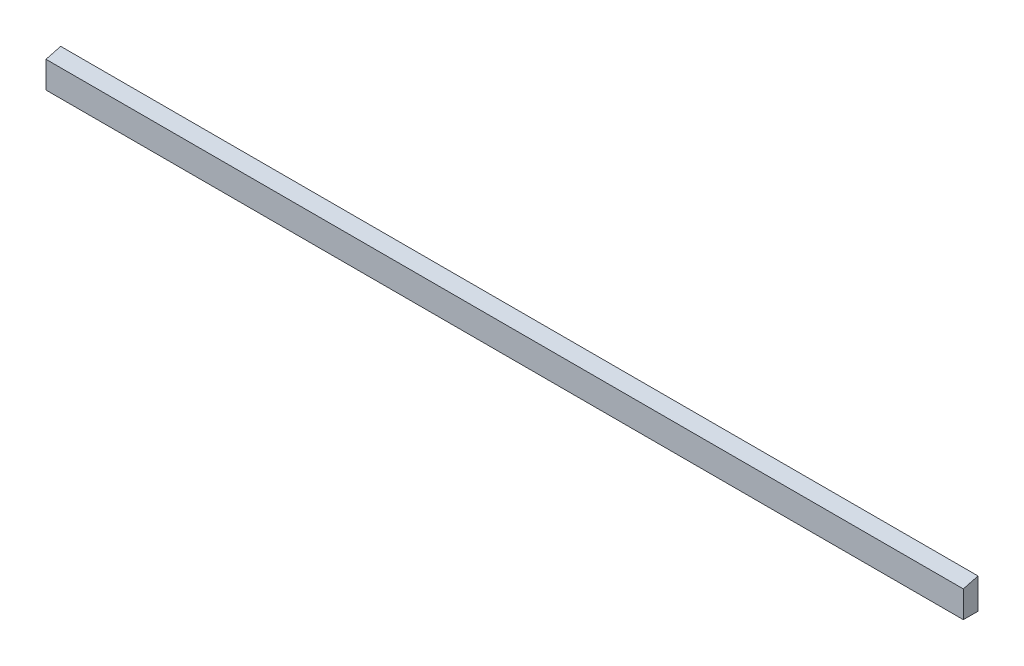
from build123d import *

# Parameters (mm, degrees)
BOSS_EXTRUDE1_DEPTH = 1143


with BuildPart() as part:
    # Sketch1 → Boss-Extrude1 (new body)
    with BuildSketch(Plane(origin=(0, 0, 0), x_dir=(0, 0, -1), z_dir=(1, 0, 0))):
        Polygon((0, 0), (-18.25625, 0), (-18.25625, 33.208252556), (0, 38.1), align=None)
    extrude(amount=BOSS_EXTRUDE1_DEPTH)


solid = part.part
